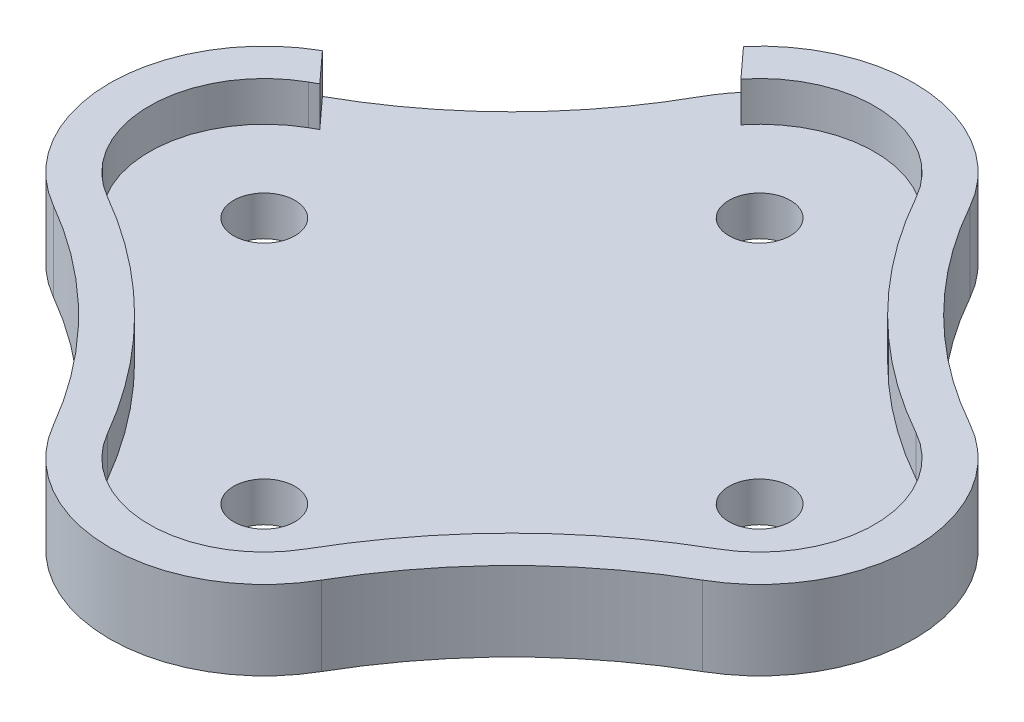
from build123d import *

# Parameters (mm, degrees)
EXTRUDE_1_DEPTH     = 4
SKETCH_1_3_R        = 1.55
EXTRUDE_2_DEPTH     = 2
CUT_EXTRUDE_1_DEPTH = 2


with BuildPart() as part:
    # 草图1 → 凸台-拉伸1 (new body)
    with BuildSketch(Plane(origin=(0, 0, 0), x_dir=(1, 0, 0), z_dir=(0, 1, 0))):
        with BuildLine():
            ThreePointArc((6.814196026, 16.295620175), (10.893644329, 10.893644329), (16.295620175, 6.814196026))
            ThreePointArc((16.295620175, 6.814196026), (20.299824853, 0.052271097), (16.386606825, -6.76271302))
            ThreePointArc((16.386606825, -6.76271302), (10.936304212, -10.936304212), (6.76271302, -16.386606825))
            ThreePointArc((6.76271302, -16.386606825), (0, -20.3), (-6.76271302, -16.386606825))
            ThreePointArc((-6.76271302, -16.386606825), (-10.936304212, -10.936304212), (-16.386606825, -6.76271302))
            ThreePointArc((-16.386606825, -6.76271302), (-20.299824853, 0.052271097), (-16.295620175, 6.814196026))
            ThreePointArc((-16.295620175, 6.814196026), (-10.893644329, 10.893644329), (-6.814196026, 16.295620175))
            ThreePointArc((-6.814196026, 16.295620175), (0, 20.3), (6.814196026, 16.295620175))
        make_face()
        with BuildLine():
            ThreePointArc((15.322384233, 5.066966276), (18.299869762, 0.038868252), (15.390040972, -5.02868404))
            ThreePointArc((15.390040972, -5.02868404), (9.52209065, -9.52209065), (5.02868404, -15.390040972))
            ThreePointArc((5.02868404, -15.390040972), (0, -18.3), (-5.02868404, -15.390040972))
            ThreePointArc((-5.02868404, -15.390040972), (-9.52209065, -9.52209065), (-15.390040972, -5.02868404))
            ThreePointArc((-15.390040972, -5.02868404), (-18.299869762, 0.038868252), (-15.322384233, 5.066966276))
            ThreePointArc((-15.322384233, 5.066966276), (-9.479430767, 9.479430767), (-5.066966276, 15.322384233))
            ThreePointArc((-5.066966276, 15.322384233), (0, 18.3), (5.066966276, 15.322384233))
            ThreePointArc((5.066966276, 15.322384233), (9.479430767, 9.479430767), (15.322384233, 5.066966276))
        make_face(mode=Mode.SUBTRACT)
    extrude(amount=EXTRUDE_1_DEPTH)

    # 草图1<3> → 凸台-拉伸2 (add)
    with BuildSketch(Plane(origin=(0, 0, 0), x_dir=(1, 0, 0), z_dir=(0, 1, 0))):
        with BuildLine():
            ThreePointArc((15.390040972, -5.02868404), (9.52209065, -9.52209065), (5.02868404, -15.390040972))
            ThreePointArc((5.02868404, -15.390040972), (0, -18.3), (-5.02868404, -15.390040972))
            ThreePointArc((-5.02868404, -15.390040972), (-9.52209065, -9.52209065), (-15.390040972, -5.02868404))
            ThreePointArc((-15.390040972, -5.02868404), (-18.299869762, 0.038868252), (-15.322384233, 5.066966276))
            ThreePointArc((-15.322384233, 5.066966276), (-9.479430767, 9.479430767), (-5.066966276, 15.322384233))
            ThreePointArc((-5.066966276, 15.322384233), (0, 18.3), (5.066966276, 15.322384233))
            ThreePointArc((5.066966276, 15.322384233), (9.479430767, 9.479430767), (15.322384233, 5.066966276))
            ThreePointArc((15.322384233, 5.066966276), (18.299869762, 0.038868252), (15.390040972, -5.02868404))
        make_face()
        with Locations(Location((0, -12.5, 0), (0, 0, 270))):
            Circle(SKETCH_1_3_R, mode=Mode.SUBTRACT)
        with Locations(Location((12.5, 0, 0), (0, 0, 270))):
            Circle(SKETCH_1_3_R, mode=Mode.SUBTRACT)
        with Locations(Location((0, 12.5, 0), (0, 0, 270))):
            Circle(SKETCH_1_3_R, mode=Mode.SUBTRACT)
        with Locations(Location((-12.5, 0, 0), (0, 0, 270))):
            Circle(SKETCH_1_3_R, mode=Mode.SUBTRACT)
    extrude(amount=EXTRUDE_2_DEPTH)

    # 草图2 → 切除-拉伸1 (cut)
    with BuildSketch(Plane(origin=(0, 4, 0), x_dir=(1, 0, 0), z_dir=(0, 1, 0))):
        Polygon((-17.675489757, 8.235718661), (-13.629873573, 3.804805697), (-2.552591164, 13.918846157), (-6.598207348, 18.349759121), align=None)
    extrude(amount=-CUT_EXTRUDE_1_DEPTH, mode=Mode.SUBTRACT)


solid = part.part
